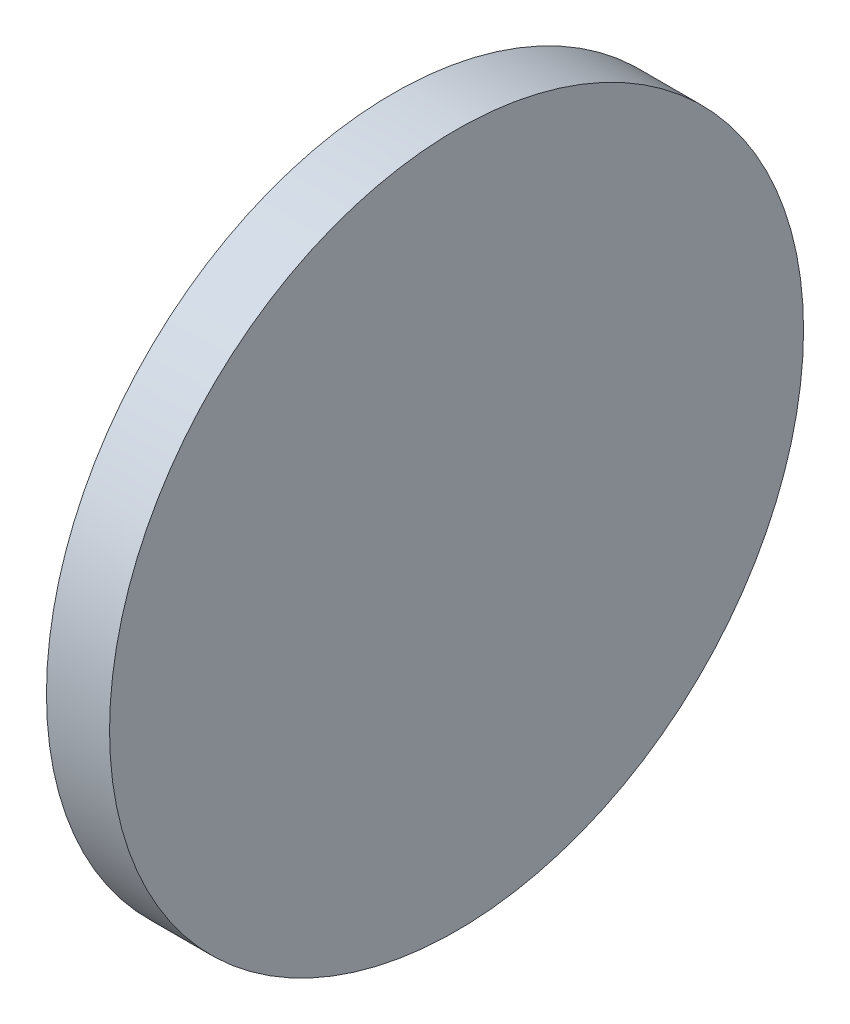
from build123d import *

# Parameters (mm, degrees)
SKETCH1_R           = 110
BOSS_EXTRUDE1_DEPTH = 20


with BuildPart() as part:
    # Sketch1 → Boss-Extrude1 (new body)
    with BuildSketch(Plane(origin=(0, 0, 0), x_dir=(0, 0, -1), z_dir=(1, 0, 0))):
        Circle(SKETCH1_R)
    extrude(amount=BOSS_EXTRUDE1_DEPTH)


solid = part.part
